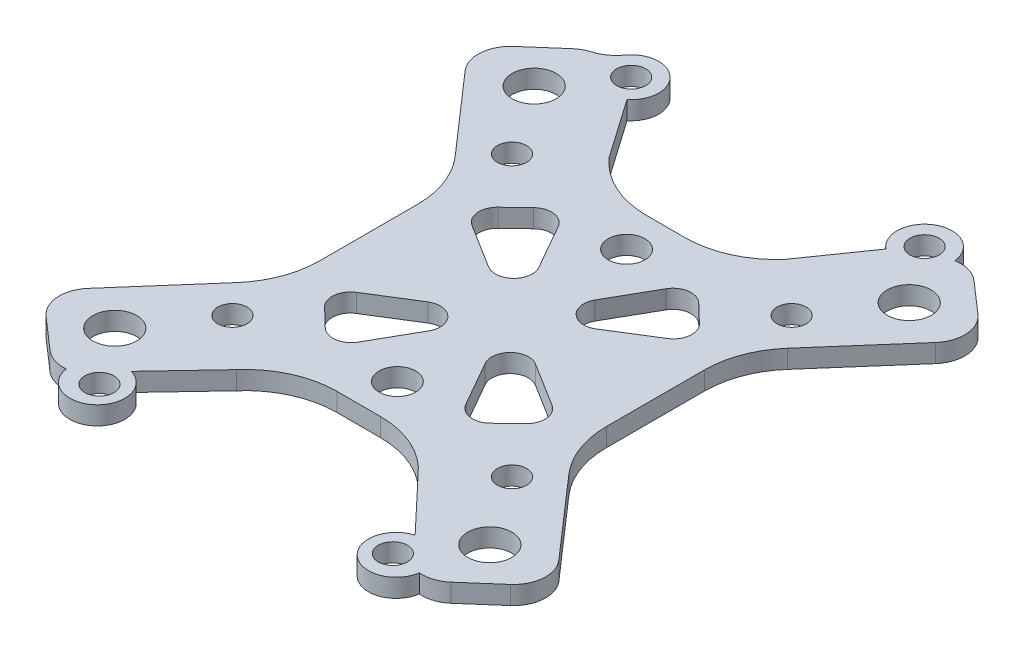
from build123d import *

# Parameters (mm, degrees)
CROQUIS2_R              = 1.5875
CROQUIS2_R_2            = 2
CROQUIS2_R_3            = 1.59
CROQUIS2_R_4            = 2.4
SALIENTE_EXTRUIR1_DEPTH = 2


with BuildPart() as part:
    # Croquis2 → Saliente-Extruir1 (new body)
    with BuildSketch(Plane(origin=(0, 0, 0), x_dir=(1, 0, 0), z_dir=(0, 1, 0))):
        with BuildLine():
            Line((-18.114669831, -11.913276785), (-25.665833323, -20.55341124))
            ThreePointArc((-25.665833323, -20.55341124), (-26.522572581, -23.091497469), (-25.333680736, -25.492001591))
            Line((-25.333680736, -25.492001591), (-21.870049663, -28.519089265))
            ThreePointArc((-21.870049663, -28.519089265), (-20.651030144, -29.211556696), (-19.258050197, -29.370070411))
            ThreePointArc((-19.258050197, -29.370070411), (-14.308280019, -31.191358923), (-15.481364298, -26.049259163))
            Line((-15.481364298, -26.049259163), (-9.898337732, -20.139552173))
            ThreePointArc((-9.898337732, -20.139552173), (-6.503541491, -17.615062127), (-2.368704963, -16.720177551))
            Line((-2.368704963, -16.720177551), (2.368704963, -16.720177551))
            ThreePointArc((2.368704963, -16.720177551), (6.503541491, -17.615062127), (9.898337732, -20.139552173))
            Line((9.898337732, -20.139552173), (15.481364298, -26.049259163))
            ThreePointArc((15.481364298, -26.049259163), (14.308280019, -31.191358923), (19.258050197, -29.370070411))
            ThreePointArc((19.258050197, -29.370070411), (20.651030144, -29.211556696), (21.870049663, -28.519089265))
            Line((21.870049663, -28.519089265), (25.333680736, -25.492001591))
            ThreePointArc((25.333680736, -25.492001591), (26.522572581, -23.091497469), (25.665833323, -20.55341124))
            Line((25.665833323, -20.55341124), (18.114669831, -11.913276785))
            ThreePointArc((18.114669831, -11.913276785), (16.282242792, -8.847169319), (15.6443026, -5.332651407))
            Line((15.6443026, -5.332651407), (15.6443026, 5.332651407))
            ThreePointArc((15.6443026, 5.332651407), (16.282242792, 8.847169319), (18.114669831, 11.913276785))
            Line((18.114669831, 11.913276785), (25.665833323, 20.55341124))
            ThreePointArc((25.665833323, 20.55341124), (26.522572581, 23.091497469), (25.333680736, 25.492001591))
            Line((25.333680736, 25.492001591), (21.870049663, 28.519089265))
            ThreePointArc((21.870049663, 28.519089265), (20.516496212, 29.244060494), (18.982893754, 29.319913825))
            ThreePointArc((18.982893754, 29.319913825), (14.561676067, 31.632721836), (14.119221437, 26.662764026))
            Line((14.119221437, 26.662764026), (9.609072603, 20.201124228))
            ThreePointArc((9.609072603, 20.201124228), (6.214276361, 17.676634182), (2.079439834, 16.781749607))
            Line((2.079439834, 16.781749607), (-2.079439834, 16.781749607))
            ThreePointArc((-2.079439834, 16.781749607), (-6.214276361, 17.676634182), (-9.609072603, 20.201124228))
            Line((-9.609072603, 20.201124228), (-14.119221437, 26.662764026))
            ThreePointArc((-14.119221437, 26.662764026), (-13.940786386, 31.181659757), (-18.441858832, 30.742792428))
            ThreePointArc((-18.441858832, 30.742792428), (-19.378360111, 29.807558957), (-20.568781865, 29.229119385))
            ThreePointArc((-20.568781865, 29.229119385), (-21.257437362, 28.943786272), (-21.870049663, 28.519089265))
            Line((-21.870049663, 28.519089265), (-25.333680736, 25.492001591))
            ThreePointArc((-25.333680736, 25.492001591), (-26.522572581, 23.091497469), (-25.665833323, 20.55341124))
            Line((-25.665833323, 20.55341124), (-18.114669831, 11.913276785))
            ThreePointArc((-18.114669831, 11.913276785), (-16.282242792, 8.847169319), (-15.6443026, 5.332651407))
            Line((-15.6443026, 5.332651407), (-15.6443026, -5.332651407))
            ThreePointArc((-15.6443026, -5.332651407), (-16.282242792, -8.847169319), (-18.114669831, -11.913276785))
        make_face()
        with Locations(Location((-16, 29, 0), (0, 0, 270))):
            Circle(CROQUIS2_R, mode=Mode.SUBTRACT)
        with Locations(Location((16, 29, 0), (0, 0, 270))):
            Circle(CROQUIS2_R, mode=Mode.SUBTRACT)
        with Locations(Location((0, 12.497128708, 0), (0, 0, 270))):
            Circle(CROQUIS2_R_2, mode=Mode.SUBTRACT)
        with Locations(Location((0, -12.497128708, 0), (0, 0, 270))):
            Circle(CROQUIS2_R_2, mode=Mode.SUBTRACT)
        with Locations(Location((-15.25, 15.25, 0), (0, 0, 270))):
            Circle(CROQUIS2_R_3, mode=Mode.SUBTRACT)
        with Locations(Location((-15.25, -15.25, 0), (0, 0, 270))):
            Circle(CROQUIS2_R_3, mode=Mode.SUBTRACT)
        with Locations(Location((-20.453154045, 22.873296448, 0), (0, 0, 270))):
            Circle(CROQUIS2_R_4, mode=Mode.SUBTRACT)
        with Locations(Location((20.453154045, 22.873296448, 0), (0, 0, 270))):
            Circle(CROQUIS2_R_4, mode=Mode.SUBTRACT)
        with Locations(Location((20.453154045, -22.873296448, 0), (0, 0, 270))):
            Circle(CROQUIS2_R_4, mode=Mode.SUBTRACT)
        with Locations(Location((-20.453154045, -22.873296448, 0), (0, 0, 270))):
            Circle(CROQUIS2_R_4, mode=Mode.SUBTRACT)
        with Locations(Location((15.25, -15.25, 0), (0, 0, 270))):
            Circle(CROQUIS2_R_3, mode=Mode.SUBTRACT)
        with Locations(Location((15.25, 15.25, 0), (0, 0, 270))):
            Circle(CROQUIS2_R_3, mode=Mode.SUBTRACT)
        with Locations(Location((-16, -29, 0), (0, 0, 270))):
            Circle(CROQUIS2_R, mode=Mode.SUBTRACT)
        with Locations(Location((16, -29, 0), (0, 0, 270))):
            Circle(CROQUIS2_R, mode=Mode.SUBTRACT)
        with BuildLine():
            Line((-8.997091839, 11.368814033), (-10.997834751, 9.446969084))
            ThreePointArc((-10.997834751, 9.446969084), (-11.601593103, 7.79748332), (-10.670982222, 6.30775488))
            Line((-10.670982222, 6.30775488), (-5.87110313, 3.313187619))
            ThreePointArc((-5.87110313, 3.313187619), (-3.426979279, 3.567667883), (-3.074423593, 5.999581964))
            Line((-3.074423593, 5.999581964), (-5.873559772, 10.915994174))
            ThreePointArc((-5.873559772, 10.915994174), (-7.324662306, 11.905756202), (-8.997091839, 11.368814033))
        make_face(mode=Mode.SUBTRACT)
        with BuildLine():
            Line((5.873559772, 10.915994174), (3.074423593, 5.999581964))
            ThreePointArc((3.074423593, 5.999581964), (3.426979279, 3.567667883), (5.87110313, 3.313187619))
            Line((5.87110313, 3.313187619), (10.670982222, 6.30775488))
            ThreePointArc((10.670982222, 6.30775488), (11.601593103, 7.79748332), (10.997834751, 9.446969084))
            Line((10.997834751, 9.446969084), (8.997091839, 11.368814033))
            ThreePointArc((8.997091839, 11.368814033), (7.324662306, 11.905756202), (5.873559772, 10.915994174))
        make_face(mode=Mode.SUBTRACT)
        with BuildLine():
            Line((8.997091839, -11.368814033), (10.997834751, -9.446969084))
            ThreePointArc((10.997834751, -9.446969084), (11.601593103, -7.79748332), (10.670982222, -6.30775488))
            Line((10.670982222, -6.30775488), (5.87110313, -3.313187619))
            ThreePointArc((5.87110313, -3.313187619), (3.426979279, -3.567667883), (3.074423593, -5.999581964))
            Line((3.074423593, -5.999581964), (5.873559772, -10.915994174))
            ThreePointArc((5.873559772, -10.915994174), (7.324662306, -11.905756202), (8.997091839, -11.368814033))
        make_face(mode=Mode.SUBTRACT)
        with BuildLine():
            Line((-5.873559772, -10.915994174), (-3.074423593, -5.999581964))
            ThreePointArc((-3.074423593, -5.999581964), (-3.426979279, -3.567667883), (-5.87110313, -3.313187619))
            Line((-5.87110313, -3.313187619), (-10.670982222, -6.30775488))
            ThreePointArc((-10.670982222, -6.30775488), (-11.601593103, -7.79748332), (-10.997834751, -9.446969084))
            Line((-10.997834751, -9.446969084), (-8.997091839, -11.368814033))
            ThreePointArc((-8.997091839, -11.368814033), (-7.324662306, -11.905756202), (-5.873559772, -10.915994174))
        make_face(mode=Mode.SUBTRACT)
    extrude(amount=SALIENTE_EXTRUIR1_DEPTH)


solid = part.part
